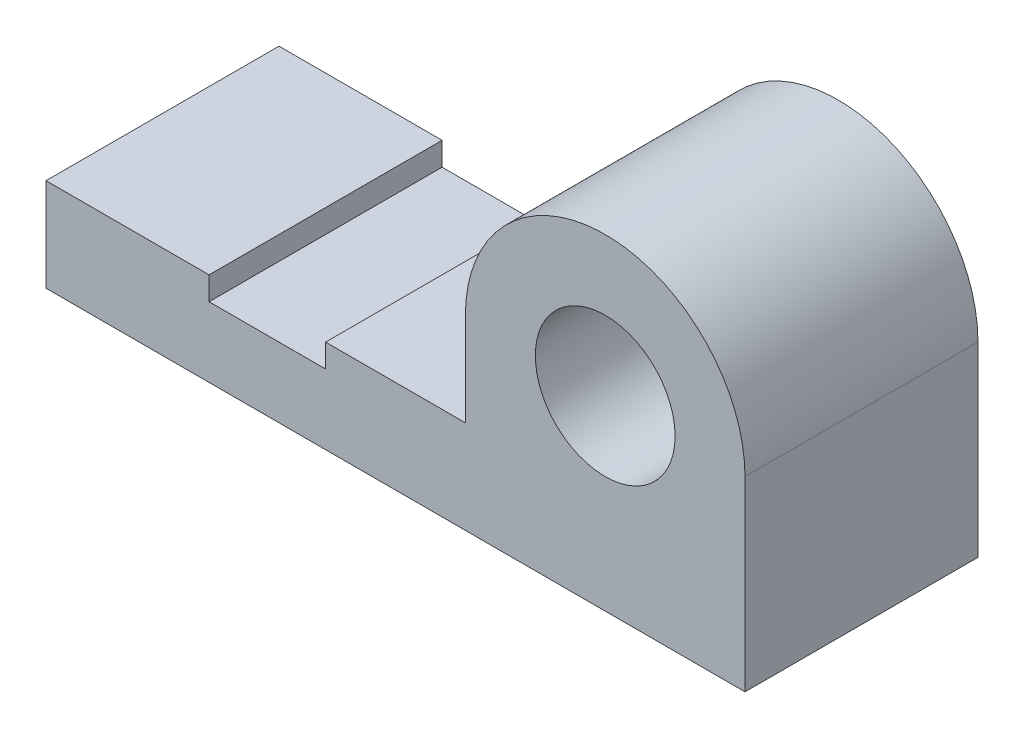
from build123d import *

# Parameters (mm, degrees)
SKETCH1_R           = 15
BOSS_EXTRUDE1_DEPTH = 50


with BuildPart() as part:
    # Sketch1 → Boss-Extrude1 (new body)
    with BuildSketch(Plane.XY):
        with BuildLine():
            ThreePointArc((-60, 40), (-30, 70), (0, 40))
            Line((0, 40), (0, 0))
            Line((0, 0), (-150, 0))
            Line((-150, 0), (-150, 20))
            Line((-150, 20), (-115, 20))
            Line((-115, 20), (-115, 15))
            Line((-115, 15), (-90, 15))
            Line((-90, 15), (-90, 20))
            Line((-90, 20), (-60, 20))
            Line((-60, 20), (-60, 40))
        make_face()
        with Locations((-30, 40)):
            Circle(SKETCH1_R, mode=Mode.SUBTRACT)
    extrude(amount=BOSS_EXTRUDE1_DEPTH)


solid = part.part
